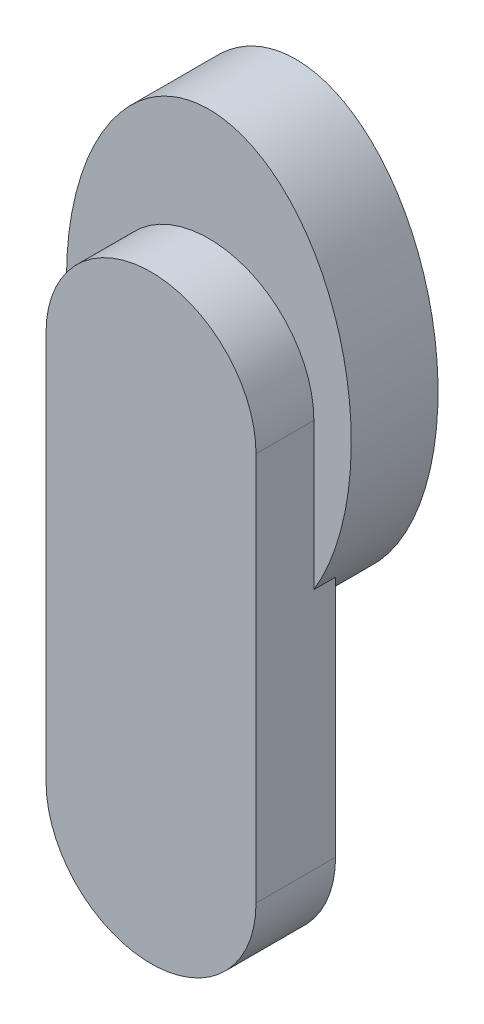
from build123d import *

# Parameters (mm, degrees)
EXTRUDE_1_DEPTH      = 10
EXTRUDE_1_DEPTH_BACK = 2
SKETCH_1_RX          = 30
SKETCH_1_RY          = 19.691511613
EXTRUDE_2_DEPTH      = 8
EXTRUDE_2_DEPTH_BACK = 3


with BuildPart() as part:
    # 草图1 → 凸台-拉伸1 (new, two sides: drawn at the far end of the back side and taken through both)
    with BuildSketch(Plane.XY.offset(-EXTRUDE_1_DEPTH_BACK)):
        with Locations(Location((0, 0), (0, 0, -90))):
            Ellipse(SKETCH_1_RX, SKETCH_1_RY)
    extrude(amount=EXTRUDE_1_DEPTH + EXTRUDE_1_DEPTH_BACK)

    # 草图2 → 凸台-拉伸2 (add, two sides: drawn at the far end of the back side and taken through both)
    with BuildSketch(Plane.XY.offset(10).offset(-EXTRUDE_2_DEPTH_BACK)):
        with BuildLine():
            Line((14.518224671, 0), (14.518224671, -53.811978273))
            ThreePointArc((14.518224671, -53.811978273), (0, -68.330202944), (-14.518224671, -53.811978273))
            Line((-14.518224671, -53.811978273), (-14.518224671, 0))
            ThreePointArc((-14.518224671, 0), (0, 14.518224671), (14.518224671, 0))
        make_face()
    extrude(amount=EXTRUDE_2_DEPTH + EXTRUDE_2_DEPTH_BACK)


solid = part.part
